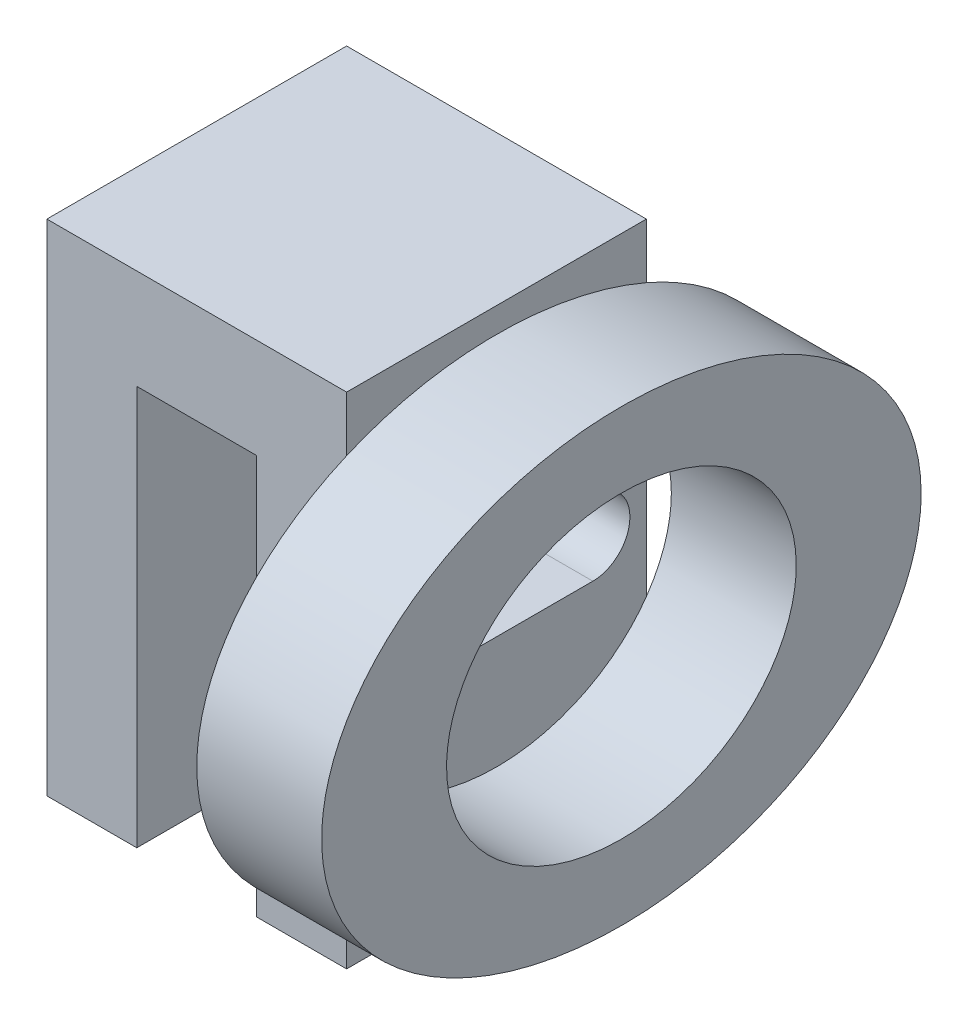
from build123d import *

# Parameters (mm, degrees)
SKETCH_1_W          = 6
SKETCH_1_H          = 6
EXTRUDE_1_DEPTH     = 10
SKETCH_2_W          = 2.4
SKETCH_2_H          = 8
CUT_EXTRUDE_1_DEPTH = 10
SKETCH_3_RX         = 6
SKETCH_3_RY         = 4.5
EXTRUDE_2_DEPTH     = 2.5
SKETCH_4_RX         = 3.5
SKETCH_4_RY         = 3
CUT_EXTRUDE_3_DEPTH = 2.5
CUT_EXTRUDE_4_DEPTH = 2


with BuildPart() as part:
    # 草图1 → 凸台-拉伸1 (new body)
    with BuildSketch(Plane(origin=(0, 0, 0), x_dir=(1, 0, 0), z_dir=(0, 1, 0))):
        with Locations((-2.112149533, 1.495327103)):
            Rectangle(SKETCH_1_W, SKETCH_1_H)
    extrude(amount=EXTRUDE_1_DEPTH)

    # 草图2 → 切除-拉伸1 (cut)
    with BuildSketch(Plane.XY.offset(1.504672897)):
        with Locations((-2.112149533, 4)):
            Rectangle(SKETCH_2_W, SKETCH_2_H)
    extrude(amount=-CUT_EXTRUDE_1_DEPTH, mode=Mode.SUBTRACT)

    # 草图3 → 凸台-拉伸2 (add)
    with BuildSketch(Plane(origin=(0.887850467, 0, 0), x_dir=(0, 0, -1), z_dir=(1, 0, 0))):
        with Locations(Location((1.495327103, 5), (0, 0, 0))):
            Ellipse(SKETCH_3_RX, SKETCH_3_RY)
    extrude(amount=EXTRUDE_2_DEPTH)

    # 草图4 → 切除-拉伸3 (cut)
    with BuildSketch(Plane(origin=(3.387850467, 0, 0), x_dir=(0, 0, -1), z_dir=(1, 0, 0))):
        with Locations(Location((1.495327103, 5), (0, 0, 180))):
            Ellipse(SKETCH_4_RX, SKETCH_4_RY)
    extrude(amount=-CUT_EXTRUDE_3_DEPTH, mode=Mode.SUBTRACT)

    # 草图5 → 切除-拉伸4 (cut)
    with BuildSketch(Plane(origin=(0.887850467, 0, 0), x_dir=(0, 0, -1), z_dir=(1, 0, 0))):
        with BuildLine():
            Line((-0.467124992, 5.741987188), (3.424164273, 5.741987188))
            ThreePointArc((3.424164273, 5.741987188), (4.166151461, 5), (3.424164273, 4.258012812))
            Line((3.424164273, 4.258012812), (-0.467124992, 4.258012812))
            ThreePointArc((-0.467124992, 4.258012812), (-1.20911218, 5), (-0.467124992, 5.741987188))
        make_face()
    extrude(amount=-CUT_EXTRUDE_4_DEPTH, mode=Mode.SUBTRACT)


solid = part.part
